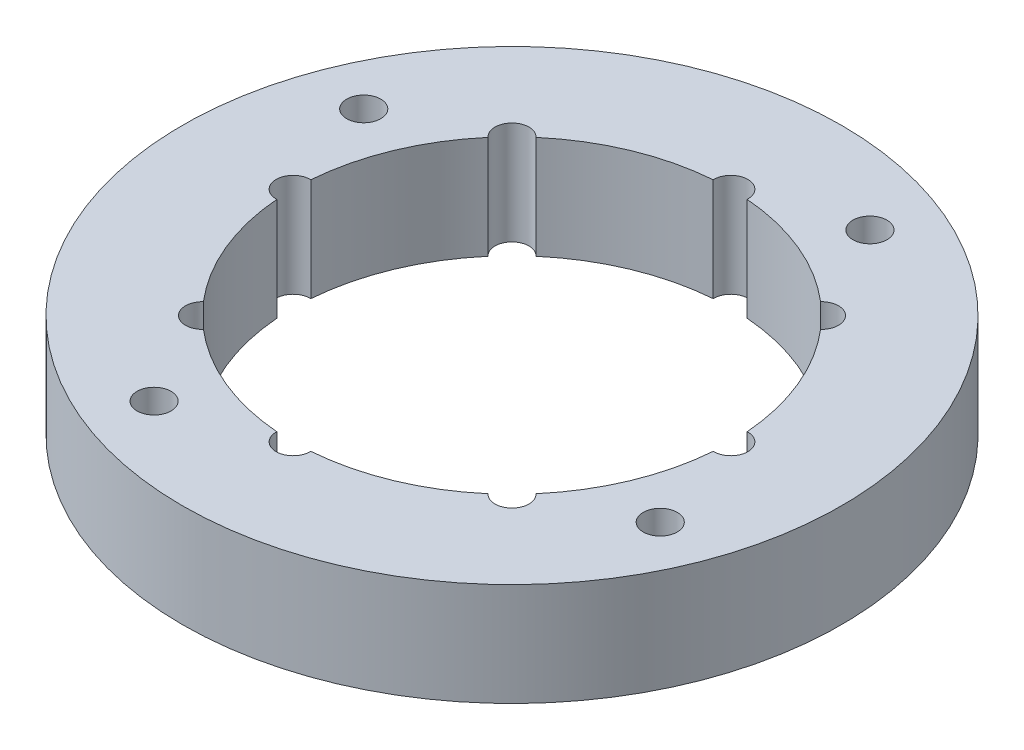
from build123d import *

# Parameters (mm, degrees)
F_1_5IN_SOCKET_R    = 40.64
F_1_5IN_SOCKET_R_2  = 2.1
BOSS_EXTRUDE1_DEPTH = 12.7


with BuildPart() as part:
    # 1.5in Socket → Boss-Extrude1 (new body)
    with BuildSketch(Plane(origin=(0, 0, 0), x_dir=(1, 0, 0), z_dir=(0, 1, 0))):
        with Locations(Location((0, 0, 0), (0, 0, 270))):
            Circle(F_1_5IN_SOCKET_R)
        with Locations(Location((12.927811712, 31.210498367, 0), (0, 0, 270))):
            Circle(F_1_5IN_SOCKET_R_2, mode=Mode.SUBTRACT)
        with Locations(Location((31.210498367, -12.927811712, 0), (0, 0, 270))):
            Circle(F_1_5IN_SOCKET_R_2, mode=Mode.SUBTRACT)
        with Locations(Location((-31.210498367, 12.927811712, 0), (0, 0, 270))):
            Circle(F_1_5IN_SOCKET_R_2, mode=Mode.SUBTRACT)
        with Locations(Location((-12.927811712, -31.210498367, 0), (0, 0, 270))):
            Circle(F_1_5IN_SOCKET_R_2, mode=Mode.SUBTRACT)
        with BuildLine():
            ThreePointArc((-20.506142942, 17.544892644), (-20.564786517, 20.564786517), (-17.544892644, 20.506142942))
            ThreePointArc((-17.544892644, 20.506142942), (-10.327669131, 24.933198884), (-2.093920166, 26.906145294))
            ThreePointArc((-2.093920166, 26.906145294), (0, 29.083), (2.093920166, 26.906145294))
            ThreePointArc((2.093920166, 26.906145294), (10.327669131, 24.933198884), (17.544892644, 20.506142942))
            ThreePointArc((17.544892644, 20.506142942), (20.564786517, 20.564786517), (20.506142942, 17.544892644))
            ThreePointArc((20.506142942, 17.544892644), (24.933198884, 10.327669131), (26.906145294, 2.093920166))
            ThreePointArc((26.906145294, 2.093920166), (29.083, 0), (26.906145294, -2.093920166))
            ThreePointArc((26.906145294, -2.093920166), (24.933198884, -10.327669131), (20.506142942, -17.544892644))
            ThreePointArc((20.506142942, -17.544892644), (20.564786517, -20.564786517), (17.544892644, -20.506142942))
            ThreePointArc((17.544892644, -20.506142942), (10.327669131, -24.933198884), (2.093920166, -26.906145294))
            ThreePointArc((2.093920166, -26.906145294), (0, -29.083), (-2.093920166, -26.906145294))
            ThreePointArc((-2.093920166, -26.906145294), (-10.327669131, -24.933198884), (-17.544892644, -20.506142942))
            ThreePointArc((-17.544892644, -20.506142942), (-20.564786517, -20.564786517), (-20.506142942, -17.544892644))
            ThreePointArc((-20.506142942, -17.544892644), (-24.933198884, -10.327669131), (-26.906145294, -2.093920166))
            ThreePointArc((-26.906145294, -2.093920166), (-29.083, 0), (-26.906145294, 2.093920166))
            ThreePointArc((-26.906145294, 2.093920166), (-24.933198884, 10.327669131), (-20.506142942, 17.544892644))
        make_face(mode=Mode.SUBTRACT)
    extrude(amount=BOSS_EXTRUDE1_DEPTH)


solid = part.part
